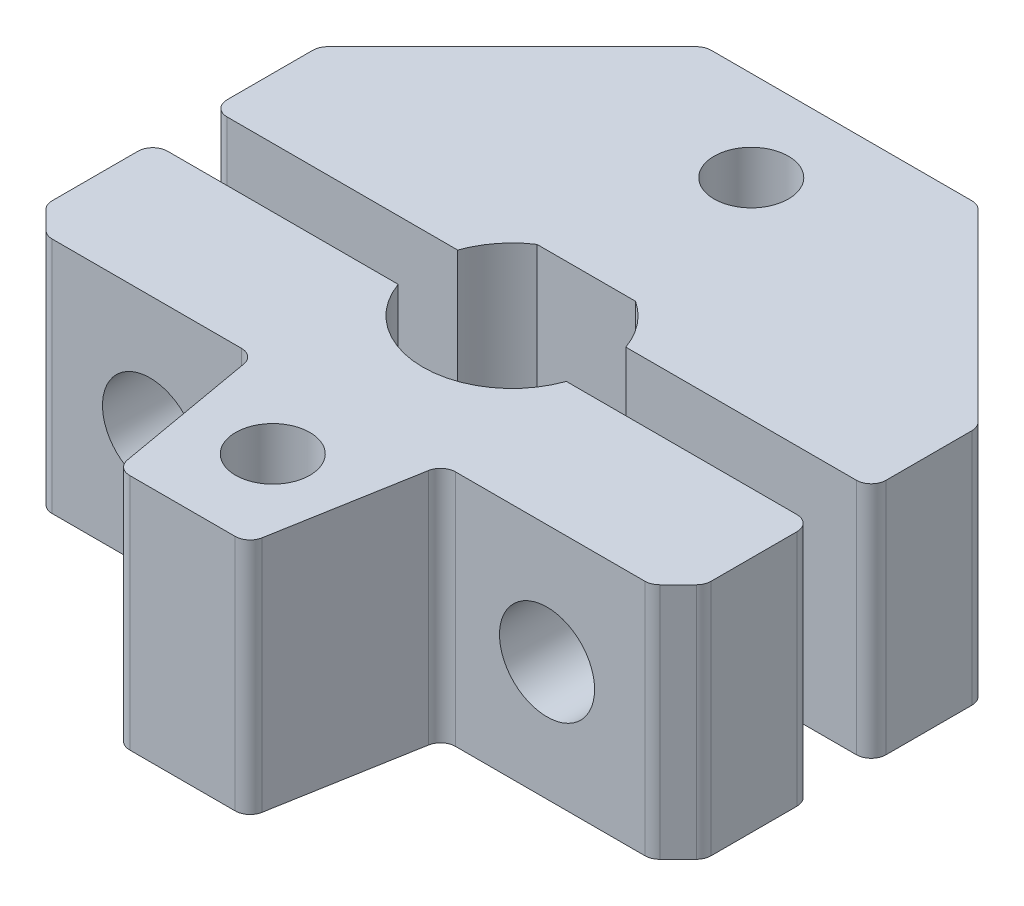
from build123d import *

# Parameters (mm, degrees)
SKETCH_1_R                  = 1
EXTRUDE_1_DEPTH             = 8
EXTRUDE_1_2_DEPTH           = 8
SKETCH_3_R                  = 1
CUT_EXTRUDE_1_DEPTH         = 22.494777849
SKETCH_4_R                  = 1.6
CUT_EXTRUDE_2_DEPTH         = 4.5
FILLET_1_R                  = 0.5
FILLET_2_R                  = 0.5
SKETCH_10_W                 = 1.25
SKETCH_10_H                 = 8
HOLE_WIZARD_M3_6_AT_2_COUNT = 2
HOLE_WIZARD_M3_6_AT_2_PITCH = 16.1
SKETCH_12_W                 = 1.25
SKETCH_12_H                 = 10.08655439
HOLE_WIZARD_M3_7_AT_2_COUNT = 2
HOLE_WIZARD_M3_7_AT_2_PITCH = 13.357511157


with BuildPart() as part:
    # 草图1 → 凸台-拉伸1 (new body)
    with BuildSketch(Plane(origin=(0, 0, 0), x_dir=(1, 0, 0), z_dir=(0, 1, 0))):
        with BuildLine():
            Line((11.08655439, 4.592201188), (4.592201188, 11.08655439))
            Line((4.592201188, 11.08655439), (-4.592201188, 11.08655439))
            Line((-4.592201188, 11.08655439), (-11.08655439, 4.592201188))
            Line((-11.08655439, 4.592201188), (-11.08655439, 1))
            Line((-11.08655439, 1), (-2.828427125, 1))
            ThreePointArc((-2.828427125, 1), (-2.365419176, 1.84520788), (-1.658312395, 2.5))
            Line((-1.658312395, 2.5), (1.658312395, 2.5))
            ThreePointArc((1.658312395, 2.5), (2.365419176, 1.84520788), (2.828427125, 1))
            Line((2.828427125, 1), (11.08655439, 1))
            Line((11.08655439, 1), (11.08655439, 4.592201188))
        make_face()
        with Locations(Location((0, 8.05, 0), (0, 0, 270))):
            Circle(SKETCH_1_R, mode=Mode.SUBTRACT)
    extrude(amount=EXTRUDE_1_DEPTH)


with BuildPart() as body_2:
    # 草图1 → Extrude 1 2 (new body)
    with BuildSketch(Plane(origin=(0, 0, 0), x_dir=(1, 0, 0), z_dir=(0, 1, 0))):
        with BuildLine():
            Line((11.08655439, -4.592201188), (11.08655439, -1))
            Line((11.08655439, -1), (2.828427125, -1))
            ThreePointArc((2.828427125, -1), (0, -3), (-2.828427125, -1))
            Line((-2.828427125, -1), (-11.08655439, -1))
            Line((-11.08655439, -1), (-11.08655439, -4.592201188))
            Line((-11.08655439, -4.592201188), (-10.178755579, -5.5))
            Line((-10.178755579, -5.5), (-3.178755579, -5.5))
            Line((-3.178755579, -5.5), (-2.19369531, -11.08655439))
            Line((-2.19369531, -11.08655439), (2.19369531, -11.08655439))
            Line((2.19369531, -11.08655439), (3.178755579, -5.5))
            Line((3.178755579, -5.5), (10.178755579, -5.5))
            Line((10.178755579, -5.5), (11.08655439, -4.592201188))
        make_face()
        with Locations(Location((0, -8.05, 0), (0, 0, 270))):
            Circle(SKETCH_1_R, mode=Mode.SUBTRACT)
    extrude(amount=EXTRUDE_1_2_DEPTH)


with BuildPart() as cut_extrude_1_tool:
    # 草图3 → 切除-拉伸1 (new, through all)
    with BuildSketch(Plane.XY.offset(5.5)):
        with Locations((-6.678755579, 4)):
            Circle(SKETCH_3_R)
        with Locations((6.678755579, 4)):
            Circle(SKETCH_3_R)
    extrude(amount=-CUT_EXTRUDE_1_DEPTH)


with BuildPart() as part_1:
    add(part.part)

    # 切除-拉伸1: cut by cut_extrude_1_tool
    add(cut_extrude_1_tool.part, mode=Mode.SUBTRACT)

    # 圆角1
    fillet_1_edges = [part_1.edges().sort_by_distance(p)[0] for p in [
        (-11.08655439, 4, -1),
        (-11.08655439, 4, -4.592201188),
        (-4.592201188, 4, -11.08655439),
        (4.592201188, 4, -11.08655439),
        (11.08655439, 4, -4.592201188),
        (11.08655439, 4, -1),
    ]]
    fillet(fillet_1_edges, radius=FILLET_1_R)

    # 草图10 → M3 螺纹孔6 (revolve, cut)
    with BuildSketch(Plane(origin=(0, 8, -8.05), x_dir=(0, 0, 1), z_dir=(1, 0, 0))):
        with Locations((0.625, 4)):
            Rectangle(SKETCH_10_W, SKETCH_10_H)
    hole_wizard_m3_6 = revolve(axis=Axis((0, 14.35, -8.05), (0, -1, 0)), mode=Mode.SUBTRACT)

    # 草图12 → M3 螺纹孔7 (revolve, cut)
    with BuildSketch(Plane(origin=(6.678755579, 4, -1), x_dir=(0, -1, 0), z_dir=(1, 0, 0))):
        with Locations((0.625, 5.043277195)):
            Rectangle(SKETCH_12_W, SKETCH_12_H)
    hole_wizard_m3_7 = revolve(axis=Axis((6.678755579, 4, 5.35), (0, 0, -1)), mode=Mode.SUBTRACT)

    # M3 螺纹孔7 at 2: M3 螺纹孔7 ×2
    with Locations(*[(-i * HOLE_WIZARD_M3_7_AT_2_PITCH, 0, 0) for i in range(1, HOLE_WIZARD_M3_7_AT_2_COUNT)]):
        add(hole_wizard_m3_7, mode=Mode.SUBTRACT)


with BuildPart() as body_2_1:
    add(body_2.part)

    # 切除-拉伸1: cut by cut_extrude_1_tool
    add(cut_extrude_1_tool.part, mode=Mode.SUBTRACT)

    # 草图4 → 切除-拉伸2 (cut)
    with BuildSketch(Plane.XY.offset(5.5)):
        with Locations((-6.678755579, 4)):
            Circle(SKETCH_4_R)
        with Locations((6.678755579, 4)):
            Circle(SKETCH_4_R)
    extrude(amount=-CUT_EXTRUDE_2_DEPTH, mode=Mode.SUBTRACT)

    # 圆角2
    fillet_2_edges = [body_2_1.edges().sort_by_distance(p)[0] for p in [
        (11.08655439, 4, 1),
        (11.08655439, 4, 4.592201188),
        (10.178755579, 4, 5.5),
        (3.178755579, 4, 5.5),
        (2.19369531, 4, 11.08655439),
        (-2.19369531, 4, 11.08655439),
        (-3.178755579, 4, 5.5),
        (-10.178755579, 4, 5.5),
        (-11.08655439, 4, 4.592201188),
        (-11.08655439, 4, 1),
    ]]
    fillet(fillet_2_edges, radius=FILLET_2_R)

    # M3 螺纹孔6 at 2: M3 螺纹孔6 ×2
    with Locations(*[(0, 0, i * HOLE_WIZARD_M3_6_AT_2_PITCH) for i in range(1, HOLE_WIZARD_M3_6_AT_2_COUNT)]):
        add(hole_wizard_m3_6, mode=Mode.SUBTRACT)


solid = Compound([part_1.part, body_2_1.part])
